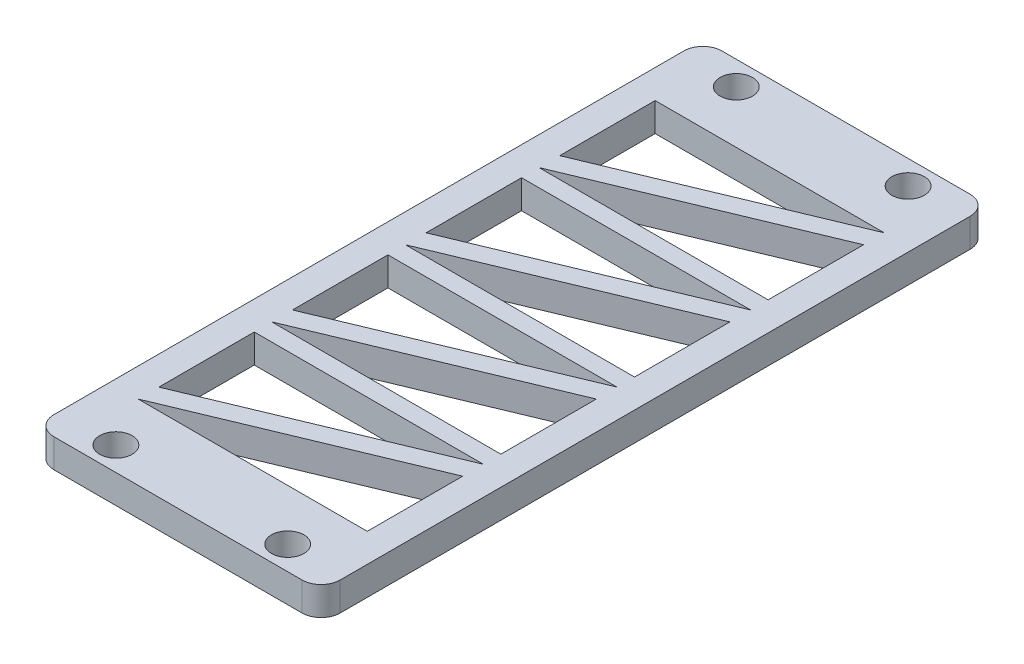
from build123d import *

# Parameters (mm, degrees)
BOSS_EXTRUDE1_DEPTH     = 3
CUT_EXTRUDE1_DEPTH      = 39.19685851
CUT_EXTRUDE1_DEPTH_BACK = 39.19685851
SKETCH2_R               = 1.7
CUT_EXTRUDE2_DEPTH      = 39.19685851
CUT_EXTRUDE2_DEPTH_BACK = 39.19685851
FILLET1_R               = 2


with BuildPart() as part:
    # Sketch1 → Boss-Extrude1 (new body)
    with BuildSketch(Plane(origin=(0, 0, 0), x_dir=(1, 0, 0), z_dir=(0, 1, 0))):
        Polygon((-15, 35), (0, 35), (15, 35), (15, 0), (15, -35), (0, -35), (-15, -35), (-15, 0), align=None)
    extrude(amount=BOSS_EXTRUDE1_DEPTH)

    # Sketch2 → Cut-Extrude1 (cut, two sides: drawn at the far end of the back side and taken through both)
    with BuildSketch(Plane(origin=(0, 3, 0), x_dir=(1, 0, 0), z_dir=(0, 1, 0)).offset(-CUT_EXTRUDE1_DEPTH_BACK)):
        with Locations(Location((-9, 32.5, 0), (0, 0, 270))):
            Circle(SKETCH2_R)
        with Locations(Location((9, 32.5, 0), (0, 0, 270))):
            Circle(SKETCH2_R)
        with Locations(Location((9, -32.5, 0), (0, 0, 90))):
            Circle(SKETCH2_R)
        with Locations(Location((-9, -32.5, 0), (0, 0, 90))):
            Circle(SKETCH2_R)
    extrude(amount=CUT_EXTRUDE1_DEPTH + CUT_EXTRUDE1_DEPTH_BACK, mode=Mode.SUBTRACT)

    # Sketch3 → Cut-Extrude2 (cut, two sides: drawn at the far end of the back side and taken through both)
    with BuildSketch(Plane(origin=(0, 3, 0), x_dir=(1, 0, 0), z_dir=(0, 1, 0)).offset(-CUT_EXTRUDE2_DEPTH_BACK)):
        Polygon((-12, 27), (0, 27), (12, 27), (-12, 17), align=None)
        Polygon((-12, 14.833333333), (12, 24.833333333), (12, 14.833333333), align=None)
        Polygon((-12, 13), (0, 13), (12, 13), (-12, 3), align=None)
        Polygon((-12, 0.833333333), (12, 10.833333333), (12, 0.833333333), align=None)
        Polygon((-12, -1), (0, -1), (12, -1), (-12, -11), align=None)
        Polygon((-12, -13.166666667), (12, -3.166666667), (12, -13.166666667), align=None)
        Polygon((-12, -15), (0, -15), (12, -15), (-12, -25), align=None)
        Polygon((-12, -27.166666667), (12, -17.166666667), (12, -27.166666667), align=None)
    extrude(amount=CUT_EXTRUDE2_DEPTH + CUT_EXTRUDE2_DEPTH_BACK, mode=Mode.SUBTRACT)

    # Fillet1
    fillet1_edges = [part.edges().sort_by_distance(p)[0] for p in [
        (-15, 1.5, -35),
        (15, 1.5, -35),
        (15, 1.5, 35),
        (-15, 1.5, 35),
    ]]
    fillet(fillet1_edges, radius=FILLET1_R)


solid = part.part
